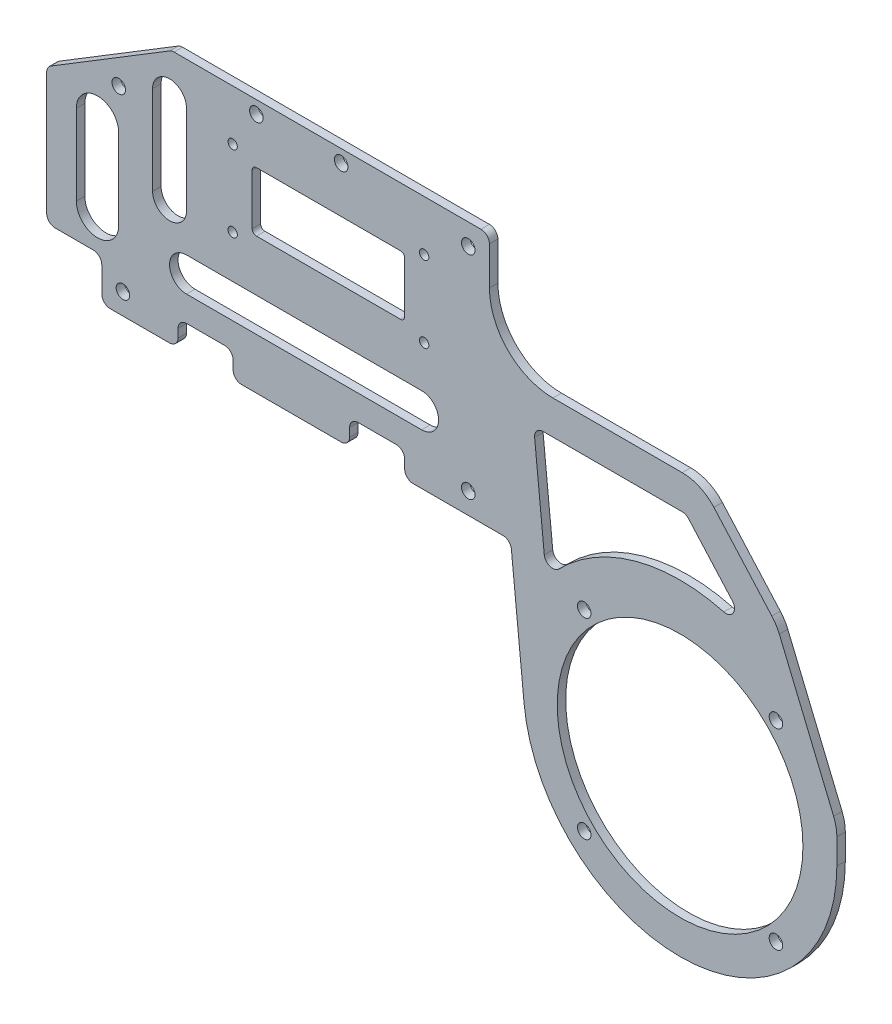
from build123d import *

# Parameters (mm, degrees)
SKETCH_1_R          = 1.6
SKETCH_1_R_2        = 29
SKETCH_1_R_3        = 1.1
EXTRUDE_1_DEPTH     = 2
FILLET_1_R          = 15
FILLET_2_R          = 10
FILLET_3_R          = 2
SKETCH_2_R          = 1.6
CUT_EXTRUDE_1_DEPTH = 124.188027016
CUT_EXTRUDE_2_DEPTH = 124.188027016
CUT_EXTRUDE_3_DEPTH = 124.188027016
FILLET_4_R          = 10


with BuildPart() as part:
    # 草图1 → 凸台-拉伸1 (new body)
    with BuildSketch(Plane.XY):
        with BuildLine():
            Line((0, 34), (0, 60))
            Line((0, 60), (-75, 60))
            Line((-75, 60), (-104.5, 42))
            Line((-104.5, 42), (-104.5, 10))
            Line((-104.5, 10), (-91.5, 10))
            Line((-91.5, 10), (-91.5, 0))
            Line((-91.5, 0), (-73.5, 0))
            Line((-73.5, 0), (-73.5, 6))
            Line((-73.5, 6), (-60.5, 6))
            Line((-60.5, 6), (-60.5, 0))
            Line((-60.5, 0), (-33, 0))
            Line((-33, 0), (-33, 6))
            Line((-33, 6), (-20, 6))
            Line((-20, 6), (-20, 0))
            Line((-20, 0), (0, 0))
            Line((0, 0), (5, 0))
            Line((5, 0), (8.183105221, -31.876446495))
            ThreePointArc((8.183105221, -31.876446495), (46.840501722, -65.154195343), (82, -28.2))
            Line((82, -28.2), (82, -2))
            Line((82, -2), (50, 34))
            Line((50, 34), (0, 34))
        make_face()
        with Locations((-86.5, 5)):
            Circle(SKETCH_1_R, mode=Mode.SUBTRACT)
        with Locations((-5, 5)):
            Circle(SKETCH_1_R, mode=Mode.SUBTRACT)
        with Locations((45, -28.2)):
            Circle(SKETCH_1_R_2, mode=Mode.SUBTRACT)
        with Locations((-35, 57)):
            Circle(SKETCH_1_R, mode=Mode.SUBTRACT)
        with Locations((-55, 57)):
            Circle(SKETCH_1_R, mode=Mode.SUBTRACT)
        with Locations((-87.5, 46.515606374)):
            Circle(SKETCH_1_R, mode=Mode.SUBTRACT)
        with Locations((-15.4, 48.1)):
            Circle(SKETCH_1_R_3, mode=Mode.SUBTRACT)
        with Locations((-15.4, 30.1)):
            Circle(SKETCH_1_R_3, mode=Mode.SUBTRACT)
        with Locations((-60.6, 48.1)):
            Circle(SKETCH_1_R_3, mode=Mode.SUBTRACT)
        with Locations((-60.6, 30.1)):
            Circle(SKETCH_1_R_3, mode=Mode.SUBTRACT)
        with Locations((-5, 55)):
            Circle(SKETCH_1_R, mode=Mode.SUBTRACT)
    extrude(amount=EXTRUDE_1_DEPTH)

    # 圆角1
    fillet_1_edges = [part.edges().sort_by_distance(p)[0] for p in [
        (0, 34, 1),
    ]]
    fillet(fillet_1_edges, radius=FILLET_1_R)

    # 圆角2
    fillet_2_edges = [part.edges().sort_by_distance(p)[0] for p in [
        (50, 34, 1),
        (82, -2, 1),
    ]]
    fillet(fillet_2_edges, radius=FILLET_2_R)

    # 圆角3
    fillet_3_edges = [part.edges().sort_by_distance(p)[0] for p in [
        (-20, 0, 1),
        (-20, 6, 1),
        (-33, 6, 1),
        (-33, 0, 1),
        (-60.5, 0, 1),
        (-60.5, 6, 1),
        (-73.5, 6, 1),
        (-73.5, 0, 1),
        (-91.5, 0, 1),
        (-91.5, 10, 1),
        (-104.5, 10, 1),
        (-104.5, 42, 1),
        (-75, 60, 1),
        (0, 60, 1),
        (5, 0, 1),
    ]]
    fillet(fillet_3_edges, radius=FILLET_3_R)

    # 草图2 → 切除-拉伸1 (cut, through all)
    with BuildSketch(Plane.XY.offset(2)):
        with Locations((67.627416998, -50.827416998)):
            Circle(SKETCH_2_R)
        with Locations((22.372583002, -50.827416998)):
            Circle(SKETCH_2_R)
        with Locations((22.372583002, -5.572583002)):
            Circle(SKETCH_2_R)
        with Locations((67.627416998, -5.572583002)):
            Circle(SKETCH_2_R)
    extrude(amount=-CUT_EXTRUDE_1_DEPTH, mode=Mode.SUBTRACT)

    # 草图3 → 切除-拉伸2 (cut, through all)
    with BuildSketch(Plane(origin=(0, 0, 0), x_dir=(-1, 0, 0), z_dir=(0, 0, -1))):
        with BuildLine():
            Line((20, 45.1), (20, 33.1))
            ThreePointArc((20, 33.1), (20.292893219, 32.392893219), (21, 32.1))
            Line((21, 32.1), (55, 32.1))
            ThreePointArc((55, 32.1), (55.707106781, 32.392893219), (56, 33.1))
            Line((56, 33.1), (56, 45.1))
            ThreePointArc((56, 45.1), (55.707106781, 45.807106781), (55, 46.1))
            Line((55, 46.1), (21, 46.1))
            ThreePointArc((21, 46.1), (20.292893219, 45.807106781), (20, 45.1))
        make_face()
        with BuildLine():
            Line((71.5, 20), (16, 20))
            ThreePointArc((16, 20), (12, 16), (16, 12))
            Line((16, 12), (71.5, 12))
            ThreePointArc((71.5, 12), (75.5, 16), (71.5, 20))
        make_face()
        with BuildLine():
            Line((79.5, 50), (79.5, 29))
            ThreePointArc((79.5, 29), (75.5, 25), (71.5, 29))
            Line((71.5, 29), (71.5, 50))
            ThreePointArc((71.5, 50), (75.5, 54), (79.5, 50))
        make_face()
        with BuildLine():
            Line((97.5, 37), (97.5, 18))
            ThreePointArc((97.5, 18), (92.5, 13), (87.5, 18))
            Line((87.5, 18), (87.5, 37))
            ThreePointArc((87.5, 37), (92.5, 42), (97.5, 37))
        make_face()
        with BuildLine():
            Line((-45.509339357, 26), (-12.653151788, 26))
            ThreePointArc((-12.653151788, 26), (-11.170341336, 25.342115182), (-10.663049368, 23.801273162))
            Line((-10.663049368, 23.801273162), (-12.946853034, 0.930667166))
            ThreePointArc((-12.946853034, 0.930667166), (-14.276095182, -0.758266904), (-16.368529004, -0.267243806))
            ThreePointArc((-16.368529004, -0.267243806), (-34.394913551, 10.368538233), (-55.324907134, 10.444485929))
            ThreePointArc((-55.324907134, 10.444485929), (-57.543460735, 11.326878506), (-57.335971128, 13.705437903))
            Line((-57.335971128, 13.705437903), (-47.004157994, 25.328727678))
            ThreePointArc((-47.004157994, 25.328727678), (-46.32865146, 25.824480112), (-45.509339357, 26))
        make_face()
    extrude(amount=-CUT_EXTRUDE_2_DEPTH, mode=Mode.SUBTRACT)

    # 草图4 → 切除-拉伸3 (cut, through all)
    with BuildSketch(Plane.XY.offset(2)):
        Polygon((67.777777778, 14), (82, -20.2), (96.250689627, 10.566455123), align=None)
    extrude(amount=-CUT_EXTRUDE_3_DEPTH, mode=Mode.SUBTRACT)

    # 圆角4
    fillet_4_edges = [part.edges().sort_by_distance(p)[0] for p in [
        (67.777777778, 14, 1),
        (82, -20.2, 1),
    ]]
    fillet(fillet_4_edges, radius=FILLET_4_R)


solid = part.part
